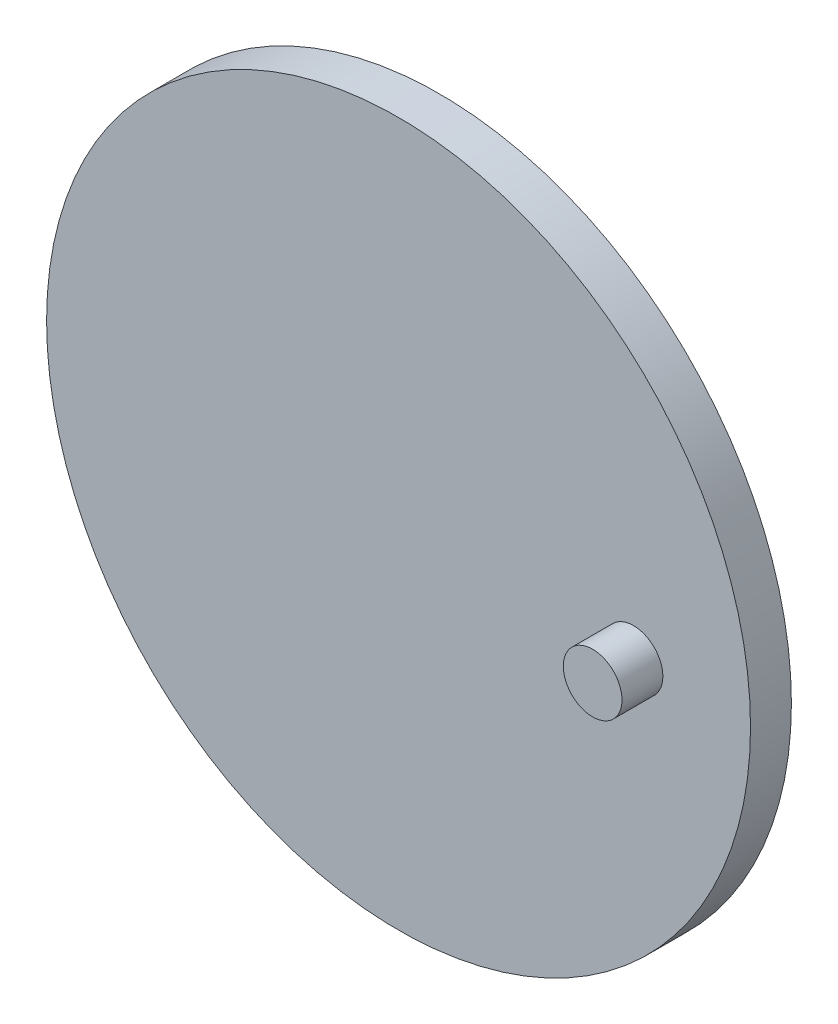
from build123d import *

# Parameters (mm, degrees)
SKETCH2_R           = 43.044310864
BOSS_EXTRUDE1_DEPTH = 5
SKETCH3_R           = 3.589046815
BOSS_EXTRUDE2_DEPTH = 5
SKETCH4_R           = 13.044310864
BOSS_EXTRUDE3_DEPTH = 5


with BuildPart() as part:
    # Sketch2 → Boss-Extrude1 (new body)
    with BuildSketch(Plane.XY):
        Circle(SKETCH2_R)
    extrude(amount=BOSS_EXTRUDE1_DEPTH)

    # Sketch3 → Boss-Extrude2 (add)
    with BuildSketch(Plane.XY.offset(5)):
        with Locations((28.73518241, 0)):
            Circle(SKETCH3_R)
    extrude(amount=BOSS_EXTRUDE2_DEPTH)

    # Sketch4 → Boss-Extrude3 (add)
    with BuildSketch(Plane(origin=(0, 0, 0), x_dir=(-1, 0, 0), z_dir=(0, 0, -1))):
        Circle(SKETCH4_R)
    extrude(amount=BOSS_EXTRUDE3_DEPTH)


solid = part.part
